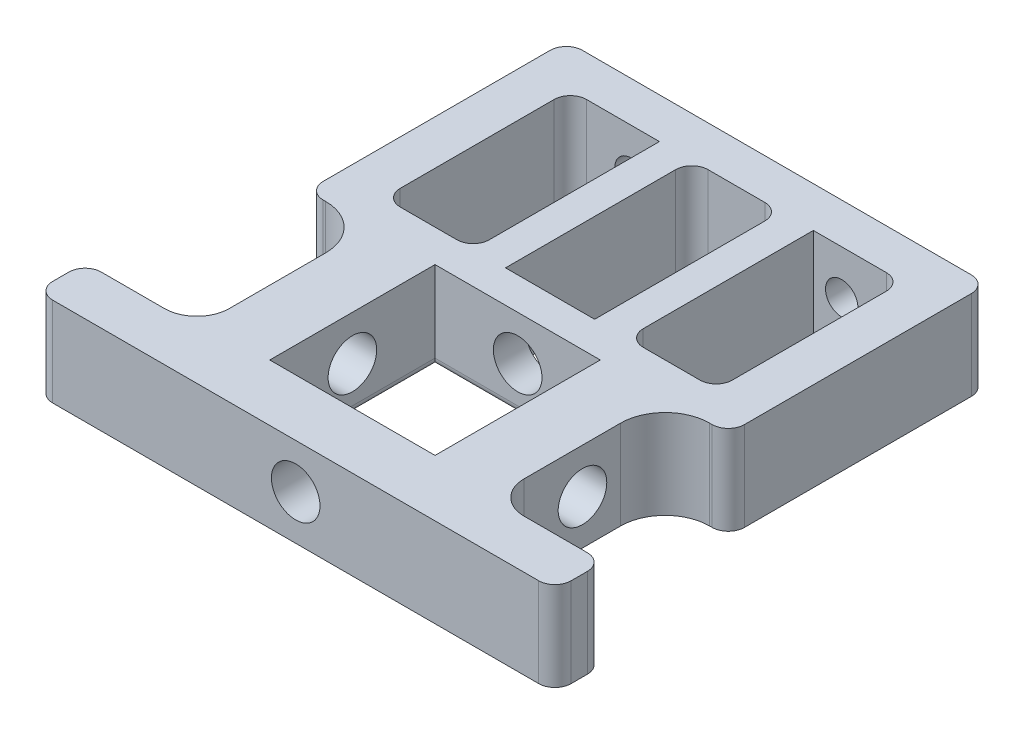
from build123d import *

# Parameters (mm, degrees)
SKETCH1_W                      = 52
SKETCH1_H                      = 32
SKETCH1_W_2                    = 11
SKETCH1_H_2                    = 23
BOSS_EXTRUDE1_DEPTH            = 11
CUT_EXTRUDE1_REACH             = 81.708
SKETCH2_R                      = 2
CUT_EXTRUDE2_REACH             = 72.426
SKETCH3_R                      = 3
CUT_EXTRUDE2_DIRECTION_2_REACH = 72.426
CUT_EXTRUDE3_REACH             = 64.04
SKETCH4_R                      = 3
CUT_EXTRUDE3_DIRECTION_2_REACH = 64.04
FILLET1_R                      = 2
FILLET2_R                      = 5.5
FILLET3_R                      = 1
SKETCH5_W                      = 13.8
SKETCH5_H                      = 6
BOSS_EXTRUDE2_DEPTH            = 11
FILLET4_R                      = 4
FILLET5_R                      = 2


with BuildPart() as part:
    # Sketch1 → Boss-Extrude1 (new body)
    # profile 1 of 2: a face of its own
    with BuildSketch(Plane(origin=(0, 0, 0), x_dir=(1, 0, 0), z_dir=(0, 1, 0))):
        with Locations((26, -16)):
            Rectangle(SKETCH1_W, SKETCH1_H)
        with Locations((26, -16.5)):
            Rectangle(SKETCH1_W_2, SKETCH1_H_2, mode=Mode.SUBTRACT)
        with Locations((11, -16.5)):
            Rectangle(SKETCH1_W_2, SKETCH1_H_2, mode=Mode.SUBTRACT)
        with Locations((41, -16.5)):
            Rectangle(SKETCH1_W_2, SKETCH1_H_2, mode=Mode.SUBTRACT)
    # profile 2 of 2: a face of its own
    with BuildSketch(Plane(origin=(0, 0, 0), x_dir=(1, 0, 0), z_dir=(0, 1, 0))):
        Polygon((15.8, -32), (7.8, -32), (7.8, -59.4), (44.2, -59.4), (44.2, -32), (36.2, -32), (36.2, -52.4), (15.8, -52.4), align=None)
    extrude(amount=BOSS_EXTRUDE1_DEPTH)

    # Sketch2 → Cut-Extrude1 (cut, up to next)
    with BuildSketch(Plane(origin=(0, 0, 0), x_dir=(-1, 0, 0), z_dir=(0, 0, -1)), mode=Mode.PRIVATE) as cut_extrude1_sk1:
        with Locations((-39, 5.5)):
            Circle(SKETCH2_R)
    cut_extrude1_tool1 = extrude(cut_extrude1_sk1.sketch, amount=-CUT_EXTRUDE1_REACH, mode=Mode.PRIVATE) & part.part
    # Sketch2 → Cut-Extrude1 (cut, up to next)
    with BuildSketch(Plane(origin=(0, 0, 0), x_dir=(-1, 0, 0), z_dir=(0, 0, -1)), mode=Mode.PRIVATE) as cut_extrude1_sk2:
        with Locations((-13, 5.5)):
            Circle(SKETCH2_R)
    cut_extrude1_tool2 = extrude(cut_extrude1_sk2.sketch, amount=-CUT_EXTRUDE1_REACH, mode=Mode.PRIVATE) & part.part
    add(cut_extrude1_tool1.solids().sort_by_distance((39, 5.5, 0))[0], mode=Mode.SUBTRACT)
    add(cut_extrude1_tool2.solids().sort_by_distance((13, 5.5, 0))[0], mode=Mode.SUBTRACT)

    # Sketch3 → Cut-Extrude2 (cut, up to next)
    with BuildSketch(Plane(origin=(15.8, 0, 0), x_dir=(0, 0, -1), z_dir=(1, 0, 0)), mode=Mode.PRIVATE) as cut_extrude2_sk1:
        with Locations((-42.2, 5.5)):
            Circle(SKETCH3_R)
    cut_extrude2_tool1 = extrude(cut_extrude2_sk1.sketch, amount=-CUT_EXTRUDE2_REACH, mode=Mode.PRIVATE) & part.part
    add(cut_extrude2_tool1.solids().sort_by_distance((15.8, 5.5, 42.2))[0], mode=Mode.SUBTRACT)

    # Sketch3 → Cut-Extrude2 direction 2 (cut, up to next)
    with BuildSketch(Plane(origin=(15.8, 0, 0), x_dir=(0, 0, -1), z_dir=(1, 0, 0)), mode=Mode.PRIVATE) as cut_extrude2_direction_2_sk1:
        with Locations((-42.2, 5.5)):
            Circle(SKETCH3_R)
    cut_extrude2_direction_2_tool1 = extrude(cut_extrude2_direction_2_sk1.sketch, amount=CUT_EXTRUDE2_DIRECTION_2_REACH, mode=Mode.PRIVATE) & part.part
    add(cut_extrude2_direction_2_tool1.solids().sort_by_distance((15.8, 5.5, 42.2))[0], mode=Mode.SUBTRACT)

    # Sketch4 → Cut-Extrude3 (cut, up to next)
    with BuildSketch(Plane.XY.offset(32), mode=Mode.PRIVATE) as cut_extrude3_sk1:
        with Locations(Location((26, 5.5, 0), (0, 0, 180))):
            Circle(SKETCH4_R)
    cut_extrude3_tool1 = extrude(cut_extrude3_sk1.sketch, amount=-CUT_EXTRUDE3_REACH, mode=Mode.PRIVATE) & part.part
    add(cut_extrude3_tool1.solids().sort_by_distance((26, 5.5, 32))[0], mode=Mode.SUBTRACT)

    # Sketch4 → Cut-Extrude3 direction 2 (cut, up to next)
    with BuildSketch(Plane.XY.offset(32), mode=Mode.PRIVATE) as cut_extrude3_direction_2_sk1:
        with Locations(Location((26, 5.5, 0), (0, 0, 180))):
            Circle(SKETCH4_R)
    cut_extrude3_direction_2_tool1 = extrude(cut_extrude3_direction_2_sk1.sketch, amount=CUT_EXTRUDE3_DIRECTION_2_REACH, mode=Mode.PRIVATE) & part.part
    add(cut_extrude3_direction_2_tool1.solids().sort_by_distance((26, 5.5, 32))[0], mode=Mode.SUBTRACT)

    # Fillet1
    fillet1_edges = [part.edges().sort_by_distance(p)[0] for p in [
        (35.5, 5.5, 28),
        (46.5, 5.5, 28),
        (46.5, 5.5, 5),
        (5.5, 5.5, 5),
        (5.5, 5.5, 28),
        (16.5, 5.5, 28),
        (20.5, 5.5, 5),
        (31.5, 5.5, 5),
        (52, 5.5, 32),
        (0, 5.5, 32),
        (0, 5.5, 0),
        (52, 5.5, 0),
    ]]
    fillet(fillet1_edges, radius=FILLET1_R)

    # Fillet2
    fillet2_edges = [part.edges().sort_by_distance(p)[0] for p in [
        (44.2, 5.5, 32),
        (7.8, 5.5, 32),
    ]]
    fillet(fillet2_edges, radius=FILLET2_R)

    # Fillet3
    fillet3_edges = [part.edges().sort_by_distance(p)[0] for p in [
        (26, 0, 52.4),
        (36.2, 0, 42.2),
        (26, 0, 32),
        (15.8, 0, 42.2),
    ]]
    fillet(fillet3_edges, radius=FILLET3_R)

    # Sketch5 → Boss-Extrude2 (add)
    with BuildSketch(Plane.XZ):
        with Locations((0.9, 56.4)):
            Rectangle(SKETCH5_W, SKETCH5_H)
        with Locations((51.1, 56.4)):
            Rectangle(SKETCH5_W, SKETCH5_H)
    extrude(amount=-BOSS_EXTRUDE2_DEPTH)

    # Fillet4
    fillet4_edges = [part.edges().sort_by_distance(p)[0] for p in [
        (7.8, 5.5, 53.4),
        (44.2, 5.5, 53.4),
    ]]
    fillet(fillet4_edges, radius=FILLET4_R)

    # Fillet5
    fillet5_edges = [part.edges().sort_by_distance(p)[0] for p in [
        (-6, 5.5, 53.4),
        (-6, 5.5, 59.4),
        (58, 5.5, 59.4),
        (58, 5.5, 53.4),
    ]]
    fillet(fillet5_edges, radius=FILLET5_R)


solid = part.part
